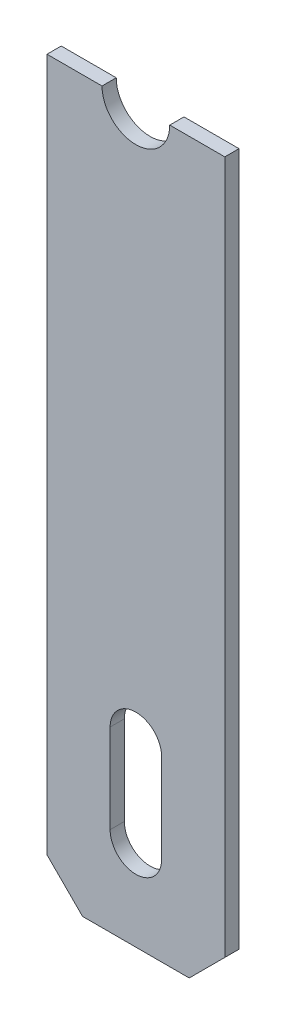
from build123d import *

# Parameters (mm, degrees)
BOSS_EXTRUDE1_DEPTH = 4


with BuildPart() as part:
    # Sketch1 → Boss-Extrude1 (new body)
    with BuildSketch(Plane.XY):
        with BuildLine():
            Line((-25, -65), (-25, 90))
            Line((-25, 90), (-9.525, 90))
            ThreePointArc((-9.525, 90), (0, 80.475), (9.525, 90))
            Line((9.525, 90), (25, 90))
            Line((25, 90), (25, -65))
            Line((25, -65), (25, -105))
            Line((25, -105), (15, -115))
            Line((15, -115), (-15, -115))
            Line((-15, -115), (-25, -105))
            Line((-25, -105), (-25, -65))
        make_face()
        with BuildLine():
            Line((-7.25, -90), (-7.25, -65))
            ThreePointArc((-7.25, -65), (0, -57.75), (7.25, -65))
            Line((7.25, -65), (7.25, -90))
            ThreePointArc((7.25, -90), (0, -97.25), (-7.25, -90))
        make_face(mode=Mode.SUBTRACT)
    extrude(amount=BOSS_EXTRUDE1_DEPTH)


solid = part.part
